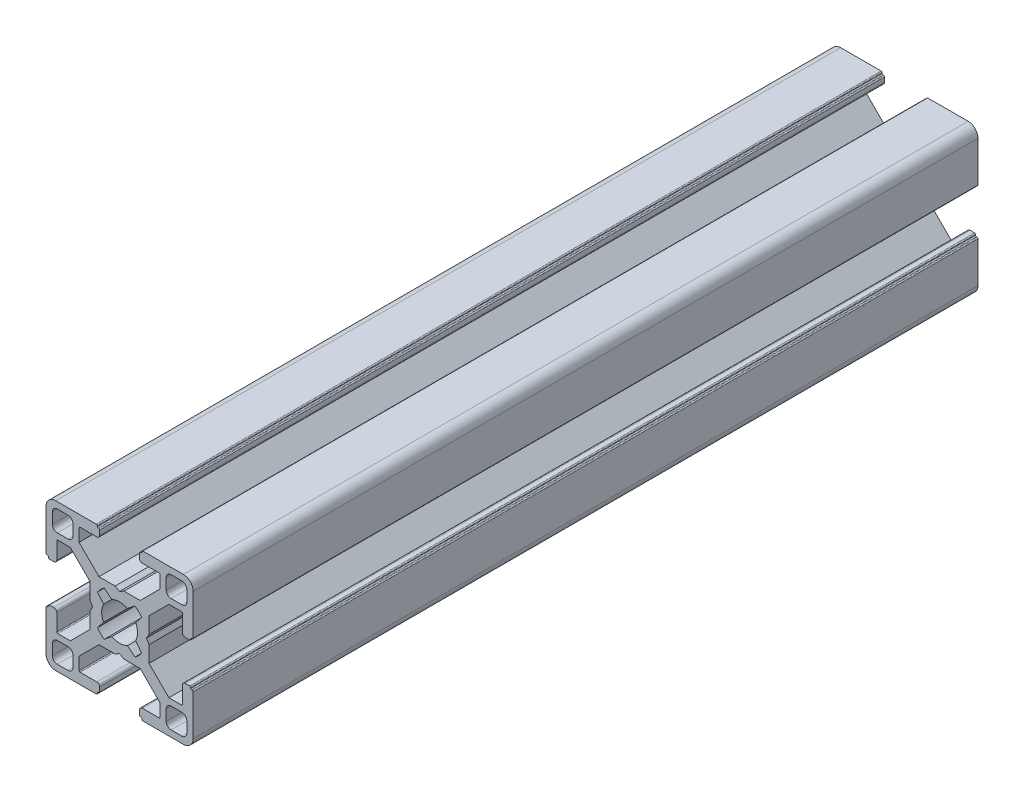
from build123d import *

# Parameters (mm, degrees)
BASE_EXTRUDE_DEPTH = 160


with BuildPart() as part:
    # Sketch1 → Base-Extrude (new body)
    with BuildSketch(Plane.XY):
        with BuildLine():
            Line((6.00446543, 0.899999619), (5.484852164, 0))
            Line((5.484852164, 0), (6.00446543, -0.899999619))
            Line((6.00446543, -0.899999619), (6.00446543, -4.204465866))
            Line((6.00446543, -4.204465866), (10.049999564, -8.25))
            Line((10.049999564, -8.25), (12.59999928, -8.25))
            ThreePointArc((12.59999928, -8.25), (12.741420837, -8.191421273), (12.799999564, -8.049999716))
            Line((12.799999564, -8.049999716), (12.799999564, -4.649999613))
            ThreePointArc((12.799999564, -4.649999613), (12.975735606, -4.225735278), (13.39999994, -4.049999237))
            Line((13.39999994, -4.049999237), (14.300000043, -4.049999237))
            ThreePointArc((14.300000043, -4.049999237), (14.4414216, -4.108577964), (14.500000327, -4.249999521))
            Line((14.500000327, -4.249999521), (14.500000327, -4.349998953))
            ThreePointArc((14.500000327, -4.349998953), (14.558579054, -4.49142051), (14.700000611, -4.549999237))
            Line((14.700000611, -4.549999237), (14.799999716, -4.549999237))
            ThreePointArc((14.799999716, -4.549999237), (14.941421273, -4.608577964), (15, -4.749999521))
            Line((15, -4.749999521), (15, -13.000000346))
            ThreePointArc((15, -13.000000346), (14.414213664, -14.414213664), (13.000000346, -15))
            Line((13.000000346, -15), (4.749999945, -15))
            ThreePointArc((4.749999945, -15), (4.60857832, -14.941421245), (4.549999564, -14.799999619))
            Line((4.549999564, -14.799999619), (4.549999564, -14.69999942))
            ThreePointArc((4.549999564, -14.69999942), (4.49142109, -14.558578474), (4.350000144, -14.5))
            Line((4.350000144, -14.5), (4.250000374, -14.5))
            ThreePointArc((4.250000374, -14.5), (4.108578753, -14.441421247), (4.05, -14.299999626))
            Line((4.05, -14.299999626), (4.05, -13.399999434))
            ThreePointArc((4.05, -13.399999434), (4.225735989, -12.975735226), (4.650000197, -12.799999237))
            Line((4.650000197, -12.799999237), (8.049999924, -12.799999237))
            ThreePointArc((8.049999924, -12.799999237), (8.191421565, -12.741420475), (8.250000327, -12.599998834))
            Line((8.250000327, -12.599998834), (8.250000327, -10.049999237))
            Line((8.250000327, -10.049999237), (4.204466193, -6))
            Line((4.204466193, -6), (0.899999946, -6))
            Line((0.899999946, -6), (0, -5.484851837))
            Line((0, -5.484851837), (-0.899999946, -6))
            Line((-0.899999946, -6), (-4.204466193, -6))
            Line((-4.204466193, -6), (-8.250000327, -10.049999237))
            Line((-8.250000327, -10.049999237), (-8.250000327, -12.599998834))
            ThreePointArc((-8.250000327, -12.599998834), (-8.191421565, -12.741420475), (-8.049999924, -12.799999237))
            Line((-8.049999924, -12.799999237), (-4.650000197, -12.799999237))
            ThreePointArc((-4.650000197, -12.799999237), (-4.225735989, -12.975735226), (-4.05, -13.399999434))
            Line((-4.05, -13.399999434), (-4.05, -14.299999626))
            ThreePointArc((-4.05, -14.299999626), (-4.108578753, -14.441421247), (-4.250000374, -14.5))
            Line((-4.250000374, -14.5), (-4.350000144, -14.5))
            ThreePointArc((-4.350000144, -14.5), (-4.49142109, -14.558578474), (-4.549999564, -14.69999942))
            Line((-4.549999564, -14.69999942), (-4.549999564, -14.799999619))
            ThreePointArc((-4.549999564, -14.799999619), (-4.60857832, -14.941421245), (-4.749999945, -15))
            Line((-4.749999945, -15), (-13.000000346, -15))
            ThreePointArc((-13.000000346, -15), (-14.414213664, -14.414213664), (-15, -13.000000346))
            Line((-15, -13.000000346), (-15, -4.749999521))
            ThreePointArc((-15, -4.749999521), (-14.941421273, -4.608577964), (-14.799999716, -4.549999237))
            Line((-14.799999716, -4.549999237), (-14.700000611, -4.549999237))
            ThreePointArc((-14.700000611, -4.549999237), (-14.558579054, -4.49142051), (-14.500000327, -4.349998953))
            Line((-14.500000327, -4.349998953), (-14.500000327, -4.249999521))
            ThreePointArc((-14.500000327, -4.249999521), (-14.4414216, -4.108577964), (-14.300000043, -4.049999237))
            Line((-14.300000043, -4.049999237), (-13.39999994, -4.049999237))
            ThreePointArc((-13.39999994, -4.049999237), (-12.975735606, -4.225735278), (-12.799999564, -4.649999613))
            Line((-12.799999564, -4.649999613), (-12.799999564, -8.049999716))
            ThreePointArc((-12.799999564, -8.049999716), (-12.741420837, -8.191421273), (-12.59999928, -8.25))
            Line((-12.59999928, -8.25), (-10.049999564, -8.25))
            Line((-10.049999564, -8.25), (-6.00446543, -4.204465866))
            Line((-6.00446543, -4.204465866), (-6.00446543, -0.899999619))
            Line((-6.00446543, -0.899999619), (-5.484852164, 0))
            Line((-5.484852164, 0), (-6.00446543, 0.899999619))
            Line((-6.00446543, 0.899999619), (-6.00446543, 4.204465866))
            Line((-6.00446543, 4.204465866), (-10.049999564, 8.25))
            Line((-10.049999564, 8.25), (-12.59999928, 8.25))
            ThreePointArc((-12.59999928, 8.25), (-12.741420837, 8.191421273), (-12.799999564, 8.049999716))
            Line((-12.799999564, 8.049999716), (-12.799999564, 4.649999613))
            ThreePointArc((-12.799999564, 4.649999613), (-12.975735606, 4.225735278), (-13.39999994, 4.049999237))
            Line((-13.39999994, 4.049999237), (-14.300000043, 4.049999237))
            ThreePointArc((-14.300000043, 4.049999237), (-14.4414216, 4.108577964), (-14.500000327, 4.249999521))
            Line((-14.500000327, 4.249999521), (-14.500000327, 4.349998953))
            ThreePointArc((-14.500000327, 4.349998953), (-14.558579054, 4.49142051), (-14.700000611, 4.549999237))
            Line((-14.700000611, 4.549999237), (-14.799999716, 4.549999237))
            ThreePointArc((-14.799999716, 4.549999237), (-14.941421273, 4.608577964), (-15, 4.749999521))
            Line((-15, 4.749999521), (-15, 13.000000346))
            ThreePointArc((-15, 13.000000346), (-14.414213664, 14.414213664), (-13.000000346, 15))
            Line((-13.000000346, 15), (-4.749999945, 15))
            ThreePointArc((-4.749999945, 15), (-4.60857832, 14.941421245), (-4.549999564, 14.799999619))
            Line((-4.549999564, 14.799999619), (-4.549999564, 14.69999942))
            ThreePointArc((-4.549999564, 14.69999942), (-4.49142109, 14.558578474), (-4.350000144, 14.5))
            Line((-4.350000144, 14.5), (-4.250000374, 14.5))
            ThreePointArc((-4.250000374, 14.5), (-4.108578753, 14.441421247), (-4.05, 14.299999626))
            Line((-4.05, 14.299999626), (-4.05, 13.399999434))
            ThreePointArc((-4.05, 13.399999434), (-4.225735989, 12.975735226), (-4.650000197, 12.799999237))
            Line((-4.650000197, 12.799999237), (-8.049999924, 12.799999237))
            ThreePointArc((-8.049999924, 12.799999237), (-8.191421565, 12.741420475), (-8.250000327, 12.599998834))
            Line((-8.250000327, 12.599998834), (-8.250000327, 10.049999237))
            Line((-8.250000327, 10.049999237), (-4.204466193, 6))
            Line((-4.204466193, 6), (-0.899999946, 6))
            Line((-0.899999946, 6), (0, 5.484851837))
            Line((0, 5.484851837), (0.899999946, 6))
            Line((0.899999946, 6), (4.204466193, 6))
            Line((4.204466193, 6), (8.250000327, 10.049999237))
            Line((8.250000327, 10.049999237), (8.250000327, 12.599998834))
            ThreePointArc((8.250000327, 12.599998834), (8.191421565, 12.741420475), (8.049999924, 12.799999237))
            Line((8.049999924, 12.799999237), (4.650000197, 12.799999237))
            ThreePointArc((4.650000197, 12.799999237), (4.225735989, 12.975735226), (4.05, 13.399999434))
            Line((4.05, 13.399999434), (4.05, 14.299999626))
            ThreePointArc((4.05, 14.299999626), (4.108578753, 14.441421247), (4.250000374, 14.5))
            Line((4.250000374, 14.5), (4.350000144, 14.5))
            ThreePointArc((4.350000144, 14.5), (4.49142109, 14.558578474), (4.549999564, 14.69999942))
            Line((4.549999564, 14.69999942), (4.549999564, 14.799999619))
            ThreePointArc((4.549999564, 14.799999619), (4.60857832, 14.941421245), (4.749999945, 15))
            Line((4.749999945, 15), (13.000000346, 15))
            ThreePointArc((13.000000346, 15), (14.414213664, 14.414213664), (15, 13.000000346))
            Line((15, 13.000000346), (15, 4.749999521))
            ThreePointArc((15, 4.749999521), (14.941421273, 4.608577964), (14.799999716, 4.549999237))
            Line((14.799999716, 4.549999237), (14.700000611, 4.549999237))
            ThreePointArc((14.700000611, 4.549999237), (14.558579054, 4.49142051), (14.500000327, 4.349998953))
            Line((14.500000327, 4.349998953), (14.500000327, 4.249999521))
            ThreePointArc((14.500000327, 4.249999521), (14.4414216, 4.108577964), (14.300000043, 4.049999237))
            Line((14.300000043, 4.049999237), (13.39999994, 4.049999237))
            ThreePointArc((13.39999994, 4.049999237), (12.975735606, 4.225735278), (12.799999564, 4.649999613))
            Line((12.799999564, 4.649999613), (12.799999564, 8.049999716))
            ThreePointArc((12.799999564, 8.049999716), (12.741420837, 8.191421273), (12.59999928, 8.25))
            Line((12.59999928, 8.25), (10.049999564, 8.25))
            Line((10.049999564, 8.25), (6.00446543, 4.204465866))
            Line((6.00446543, 4.204465866), (6.00446543, 0.899999619))
        make_face()
        with BuildLine():
            Line((13.70000109, 12.700000398), (13.70000109, 10.499999635))
            ThreePointArc((13.70000109, 10.499999635), (13.407107874, 9.792892851), (12.70000109, 9.499999635))
            Line((12.70000109, 9.499999635), (10.500000327, 9.499999635))
            ThreePointArc((10.500000327, 9.499999635), (9.792893543, 9.792892851), (9.500000327, 10.499999635))
            Line((9.500000327, 10.499999635), (9.500000327, 12.700000398))
            ThreePointArc((9.500000327, 12.700000398), (9.792893543, 13.407107182), (10.500000327, 13.700000398))
            Line((10.500000327, 13.700000398), (12.70000109, 13.700000398))
            ThreePointArc((12.70000109, 13.700000398), (13.407107874, 13.407107182), (13.70000109, 12.700000398))
        make_face(mode=Mode.SUBTRACT)
        with BuildLine():
            Line((3.135929412, 4.518400903), (1.600129524, 3.280561767))
            ThreePointArc((1.600129524, 3.280561767), (0, 3.65), (-1.600129524, 3.280561767))
            Line((-1.600129524, 3.280561767), (-3.135929412, 4.518400903))
            ThreePointArc((-3.135929412, 4.518400903), (-3.881002259, 3.897155561), (-4.505336892, 3.154669473))
            Line((-4.505336892, 3.154669473), (-3.280561732, 1.600129597))
            ThreePointArc((-3.280561732, 1.600129597), (-3.65, 0), (-3.280561732, -1.600129597))
            Line((-3.280561732, -1.600129597), (-4.505336892, -3.154669473))
            ThreePointArc((-4.505336892, -3.154669473), (-3.881002259, -3.897155561), (-3.135929412, -4.518400903))
            Line((-3.135929412, -4.518400903), (-1.600129524, -3.280561767))
            ThreePointArc((-1.600129524, -3.280561767), (0, -3.65), (1.600129524, -3.280561767))
            Line((1.600129524, -3.280561767), (3.135929412, -4.518400903))
            ThreePointArc((3.135929412, -4.518400903), (3.881002259, -3.897155561), (4.505336892, -3.154669473))
            Line((4.505336892, -3.154669473), (3.280561732, -1.600129597))
            ThreePointArc((3.280561732, -1.600129597), (3.65, 0), (3.280561732, 1.600129597))
            Line((3.280561732, 1.600129597), (4.505336892, 3.154669473))
            ThreePointArc((4.505336892, 3.154669473), (3.881002259, 3.897155561), (3.135929412, 4.518400903))
        make_face(mode=Mode.SUBTRACT)
        with BuildLine():
            Line((-13.70000109, -12.700000398), (-13.70000109, -10.499999635))
            ThreePointArc((-13.70000109, -10.499999635), (-13.407107874, -9.792892851), (-12.70000109, -9.499999635))
            Line((-12.70000109, -9.499999635), (-10.500000327, -9.499999635))
            ThreePointArc((-10.500000327, -9.499999635), (-9.792893543, -9.792892851), (-9.500000327, -10.499999635))
            Line((-9.500000327, -10.499999635), (-9.500000327, -12.700000398))
            ThreePointArc((-9.500000327, -12.700000398), (-9.792893543, -13.407107182), (-10.500000327, -13.700000398))
            Line((-10.500000327, -13.700000398), (-12.70000109, -13.700000398))
            ThreePointArc((-12.70000109, -13.700000398), (-13.407107874, -13.407107182), (-13.70000109, -12.700000398))
        make_face(mode=Mode.SUBTRACT)
        with BuildLine():
            Line((10.500000327, -13.700000398), (12.70000109, -13.700000398))
            ThreePointArc((12.70000109, -13.700000398), (13.407107874, -13.407107182), (13.70000109, -12.700000398))
            Line((13.70000109, -12.700000398), (13.70000109, -10.499999635))
            ThreePointArc((13.70000109, -10.499999635), (13.407107874, -9.792892851), (12.70000109, -9.499999635))
            Line((12.70000109, -9.499999635), (10.500000327, -9.499999635))
            ThreePointArc((10.500000327, -9.499999635), (9.792893543, -9.792892851), (9.500000327, -10.499999635))
            Line((9.500000327, -10.499999635), (9.500000327, -12.700000398))
            ThreePointArc((9.500000327, -12.700000398), (9.792893543, -13.407107182), (10.500000327, -13.700000398))
        make_face(mode=Mode.SUBTRACT)
        with BuildLine():
            Line((-10.500000327, 13.700000398), (-12.70000109, 13.700000398))
            ThreePointArc((-12.70000109, 13.700000398), (-13.407107874, 13.407107182), (-13.70000109, 12.700000398))
            Line((-13.70000109, 12.700000398), (-13.70000109, 10.499999635))
            ThreePointArc((-13.70000109, 10.499999635), (-13.407107874, 9.792892851), (-12.70000109, 9.499999635))
            Line((-12.70000109, 9.499999635), (-10.500000327, 9.499999635))
            ThreePointArc((-10.500000327, 9.499999635), (-9.792893543, 9.792892851), (-9.500000327, 10.499999635))
            Line((-9.500000327, 10.499999635), (-9.500000327, 12.700000398))
            ThreePointArc((-9.500000327, 12.700000398), (-9.792893543, 13.407107182), (-10.500000327, 13.700000398))
        make_face(mode=Mode.SUBTRACT)
    extrude(amount=-BASE_EXTRUDE_DEPTH)


solid = part.part
